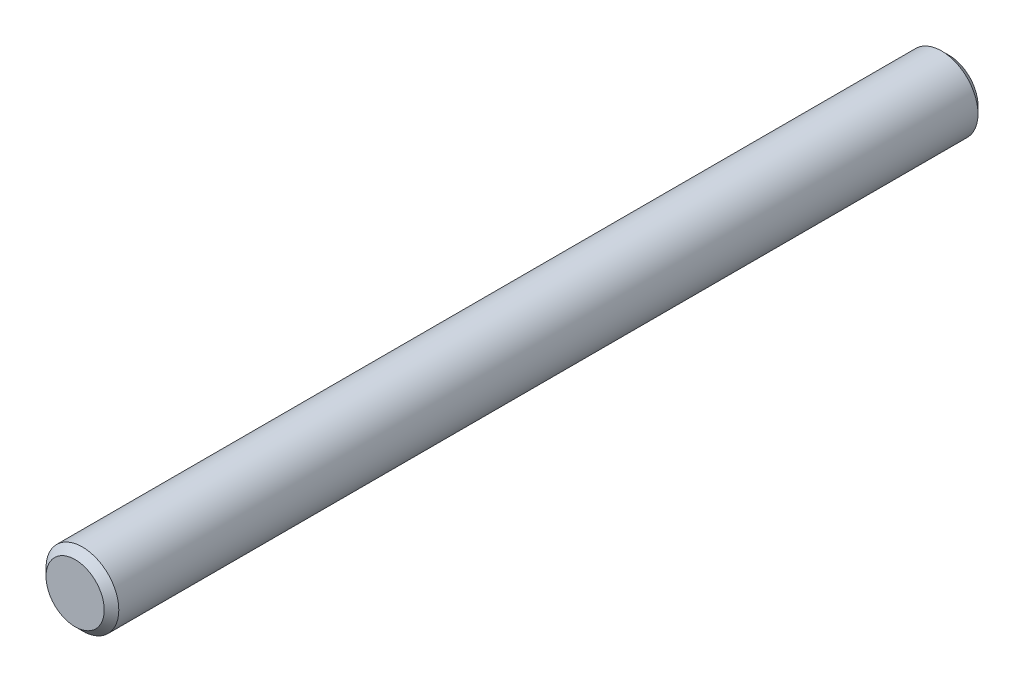
from build123d import *

# Parameters (mm, degrees)
SKIZZE1_R                       = 2.5
AUFSATZ_LINEAR_AUSTRAGEN1_DEPTH = 60
FASE1_SIZE                      = 0.5


with BuildPart() as part:
    # Skizze1 → Aufsatz-Linear austragen1 (new body)
    with BuildSketch(Plane.XY):
        Circle(SKIZZE1_R)
    extrude(amount=AUFSATZ_LINEAR_AUSTRAGEN1_DEPTH)

    # Fase1
    fase1_edges = [part.edges().sort_by_distance(p)[0] for p in [
        (-2.5, 0, 0),
        (-2.5, 0, 60),
    ]]
    chamfer(fase1_edges, length=FASE1_SIZE)


solid = part.part
